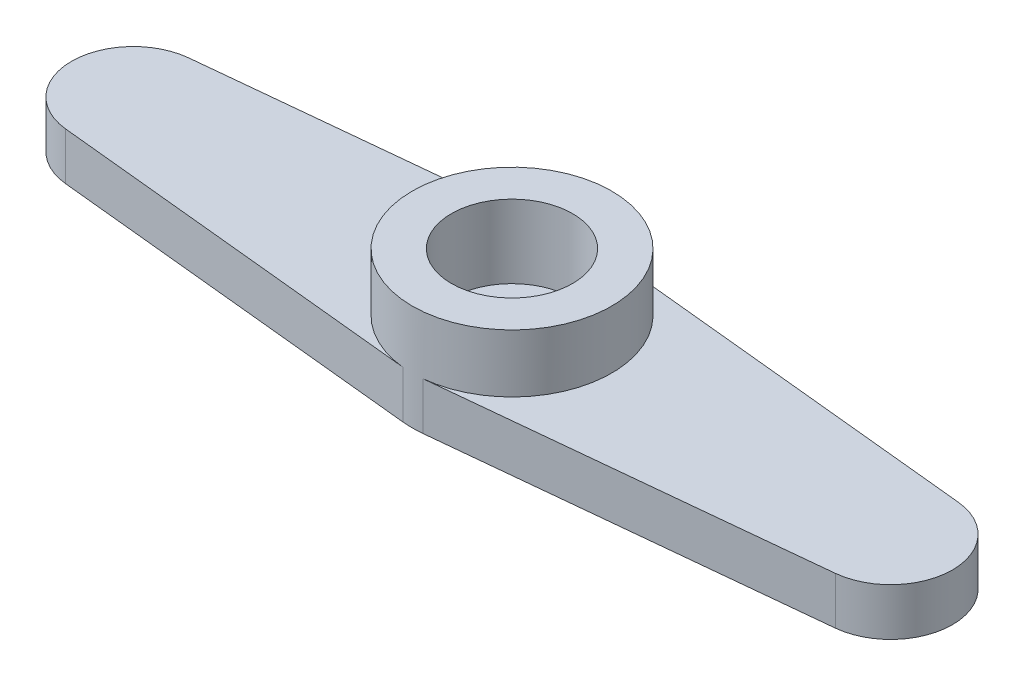
from build123d import *

# Parameters (mm, degrees)
BOSS_EXTRU_1_DEPTH      = 1.88
ESQUISSE2_R             = 3.95
BOSS_EXTRU_2_DEPTH      = 2.3
ESQUISSE3_R             = 2.4
ENL_V_MAT_EXTRU_1_DEPTH = 2.9
ESQUISSE4_R             = 1
ENL_V_MAT_EXTRU_2_DEPTH = 2.9


with BuildPart() as part:
    # Esquisse1 → Boss.-Extru.1 (new body)
    with BuildSketch(Plane(origin=(0, 0, 0), x_dir=(1, 0, 0), z_dir=(0, 1, 0))):
        with BuildLine():
            Line((-0.395, 3.930200377), (-15.245, 2.437719221))
            ThreePointArc((-15.245, 2.437719221), (-17.45, 0), (-15.245, -2.437719221))
            Line((-15.245, -2.437719221), (-0.395, -3.930200377))
            ThreePointArc((-0.395, -3.930200377), (0, -3.95), (0.395, -3.930200377))
            Line((0.395, -3.930200377), (15.245, -2.437719221))
            ThreePointArc((15.245, -2.437719221), (17.45, 0), (15.245, 2.437719221))
            Line((15.245, 2.437719221), (0.395, 3.930200377))
            ThreePointArc((0.395, 3.930200377), (0, 3.95), (-0.395, 3.930200377))
        make_face()
    extrude(amount=BOSS_EXTRU_1_DEPTH)

    # Esquisse2 → Boss.-Extru.2 (add)
    with BuildSketch(Plane(origin=(0, 1.88, 0), x_dir=(1, 0, 0), z_dir=(0, 1, 0))):
        with Locations(Location((0, 0, 0), (0, 0, 84.260829523))):
            Circle(ESQUISSE2_R)
    extrude(amount=BOSS_EXTRU_2_DEPTH)

    # Esquisse3 → Enlèv. mat.-Extru.1 (cut)
    with BuildSketch(Plane(origin=(0, 4.18, 0), x_dir=(1, 0, 0), z_dir=(0, 1, 0))):
        with Locations(Location((0, 0, 0), (0, 0, 270))):
            Circle(ESQUISSE3_R)
    extrude(amount=-ENL_V_MAT_EXTRU_1_DEPTH, mode=Mode.SUBTRACT)

    # Esquisse4 → Enlèv. mat.-Extru.2 (cut)
    with BuildSketch(Plane(origin=(0, 1.28, 0), x_dir=(1, 0, 0), z_dir=(0, 1, 0))):
        with Locations(Location((0, 0, 0), (0, 0, 270))):
            Circle(ESQUISSE4_R)
    extrude(amount=-ENL_V_MAT_EXTRU_2_DEPTH, mode=Mode.SUBTRACT)


solid = part.part
